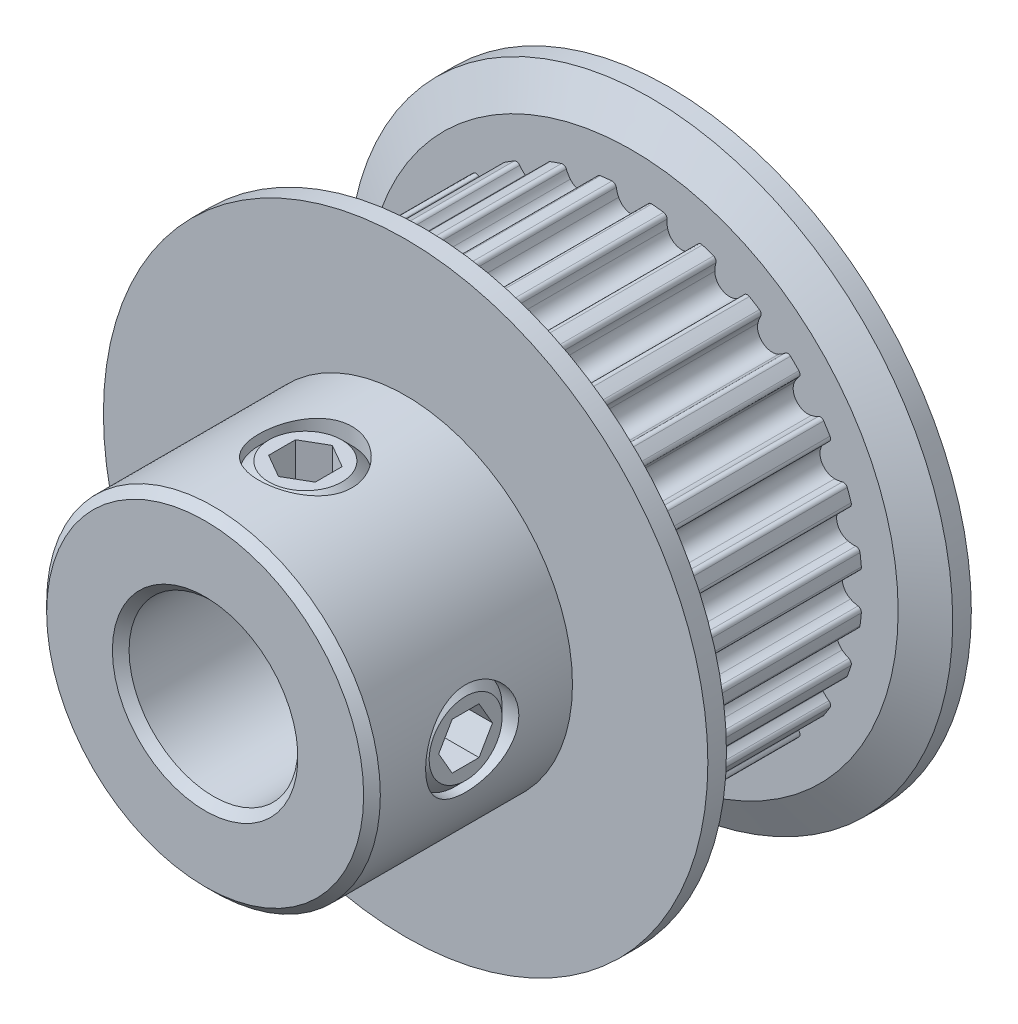
from build123d import *

# Parameters (mm, degrees)
CUT_EXTRUDE1_START = -0.2149
CUT_EXTRUDE1_DEPTH = 7.11
CIRPATTERN1_COUNT  = 28
SKETCH4_R          = 1.7526
CUT_EXTRUDE2_DEPTH = 19.28984758
CUT_EXTRUDE3_DEPTH = 1.31445
CIRPATTERN2_COUNT  = 2
CIRPATTERN2_ANGLE  = 90
CHAMFER1_SIZE      = 0.31375


with BuildPart() as part:
    # Sketch2 → Revolve1 (revolve)
    with BuildSketch(Plane(origin=(0, 0, 0), x_dir=(0, 0, -1), z_dir=(1, 0, 0)), mode=Mode.PRIVATE) as revolve1_sk:
        Polygon((-8.7249, 3.175), (8.7249, 3.175), (8.7249, 11.3665), (8.0249, 11.3665), (7.3249, 10.014), (7.3249, 8.6615), (0.2149, 8.6615), (0.2149, 10.014), (-0.4851, 11.3665), (-1.1851, 11.3665), (-1.1851, 6.275), (-8.7249, 6.275), align=None)
    revolve(revolve1_sk.sketch.rotate(Axis((0, 0, 8.7249), (0, 0, -1)), 90), axis=Axis((0, 0, 8.7249), (0, 0, -1)))

    # Sketch3 → Cut-Extrude1 (cut)
    with BuildSketch(Plane.XY.offset(CUT_EXTRUDE1_START)):
        with BuildLine():
            Line((2.599137227, 11.3665), (-2.599137227, 11.3665))
            Line((-2.599137227, 11.3665), (-1.93075951, 8.443562634))
            ThreePointArc((-1.93075951, 8.443562634), (-1.342835417, 8.55677365), (-0.748494926, 8.629098307))
            ThreePointArc((-0.748494926, 8.629098307), (-0.643240407, 8.597905681), (-0.587419547, 8.503377774))
            ThreePointArc((-0.587419547, 8.503377774), (-0.55348797, 8.360068928), (-0.498876404, 8.223297753))
            ThreePointArc((-0.498876404, 8.223297753), (0, 7.9115), (0.498876404, 8.223297753))
            ThreePointArc((0.498876404, 8.223297753), (0.55348797, 8.360068928), (0.587419547, 8.503377774))
            ThreePointArc((0.587419547, 8.503377774), (0.643240407, 8.597905681), (0.748494926, 8.629098307))
            ThreePointArc((0.748494926, 8.629098307), (1.342835417, 8.55677365), (1.93075951, 8.443562634))
            Line((1.93075951, 8.443562634), (2.599137227, 11.3665))
        make_face()
    cut_extrude1 = extrude(amount=-CUT_EXTRUDE1_DEPTH, mode=Mode.SUBTRACT)

    # CirPattern1: Cut-Extrude1 ×28 about axis
    cirpattern1_axis = Axis((0, 0, 0), (0, 0, 1))
    for i in range(1, CIRPATTERN1_COUNT):
        add(cut_extrude1.rotate(cirpattern1_axis, i * 360 / CIRPATTERN1_COUNT), mode=Mode.SUBTRACT)

    # Sketch4 → Cut-Extrude2 (cut, through all)
    with BuildSketch(Plane(origin=(0, 0, 0), x_dir=(0, -1, 0), z_dir=(1, 0, 0))):
        with Locations(Location((0, -4.955, 0), (0, 0, 270.000000003))):
            Circle(SKETCH4_R)
    cut_extrude2 = extrude(amount=CUT_EXTRUDE2_DEPTH, mode=Mode.SUBTRACT)

    # Sketch5 → Revolve2 (revolve)
    with BuildSketch(Plane.XY.offset(4.955), mode=Mode.PRIVATE) as revolve2_sk:
        Polygon((3.175, -1.3716), (3.175, 0), (6.02528159, 0), (6.02528159, -1.3716), (5.64428159, -1.7526), (3.556, -1.7526), align=None)
    revolve2 = revolve(revolve2_sk.sketch.rotate(Axis((3.175, 0, 4.955), (1, 0, 0)), 270), axis=Axis((3.175, 0, 4.955), (1, 0, 0)))

    # Sketch6 → Cut-Extrude3 (cut)
    with BuildSketch(Plane(origin=(6.02528159, 5.384140679, 0), x_dir=(0, -1, 0), z_dir=(-1, 0, 0))):
        Polygon((5.384140679, 5.966864082), (4.507840679, 5.460932041), (4.507840679, 4.449067959), (5.384140679, 3.943135918), (6.260440679, 4.449067959), (6.260440679, 5.460932041), align=None)
    cut_extrude3 = extrude(amount=CUT_EXTRUDE3_DEPTH, mode=Mode.SUBTRACT)

    # CirPattern2: Cut-Extrude2, Revolve2, Cut-Extrude3 ×2 about axis
    cirpattern2_axis = Axis((0, 0, 0), (0, 0, 1))
    add([cut_extrude2.rotate(cirpattern2_axis, i * CIRPATTERN2_ANGLE / (CIRPATTERN2_COUNT - 1)) for i in range(1, CIRPATTERN2_COUNT)], mode=Mode.SUBTRACT)
    add([revolve2.rotate(cirpattern2_axis, i * CIRPATTERN2_ANGLE / (CIRPATTERN2_COUNT - 1)) for i in range(1, CIRPATTERN2_COUNT)])
    add([cut_extrude3.rotate(cirpattern2_axis, i * CIRPATTERN2_ANGLE / (CIRPATTERN2_COUNT - 1)) for i in range(1, CIRPATTERN2_COUNT)], mode=Mode.SUBTRACT)

    # Chamfer1
    chamfer1_edges = [part.edges().sort_by_distance(p)[0] for p in [
        (-6.275, 0, 8.7249),
        (-3.175, 0, 8.7249),
    ]]
    chamfer(chamfer1_edges, length=CHAMFER1_SIZE)


solid = part.part
